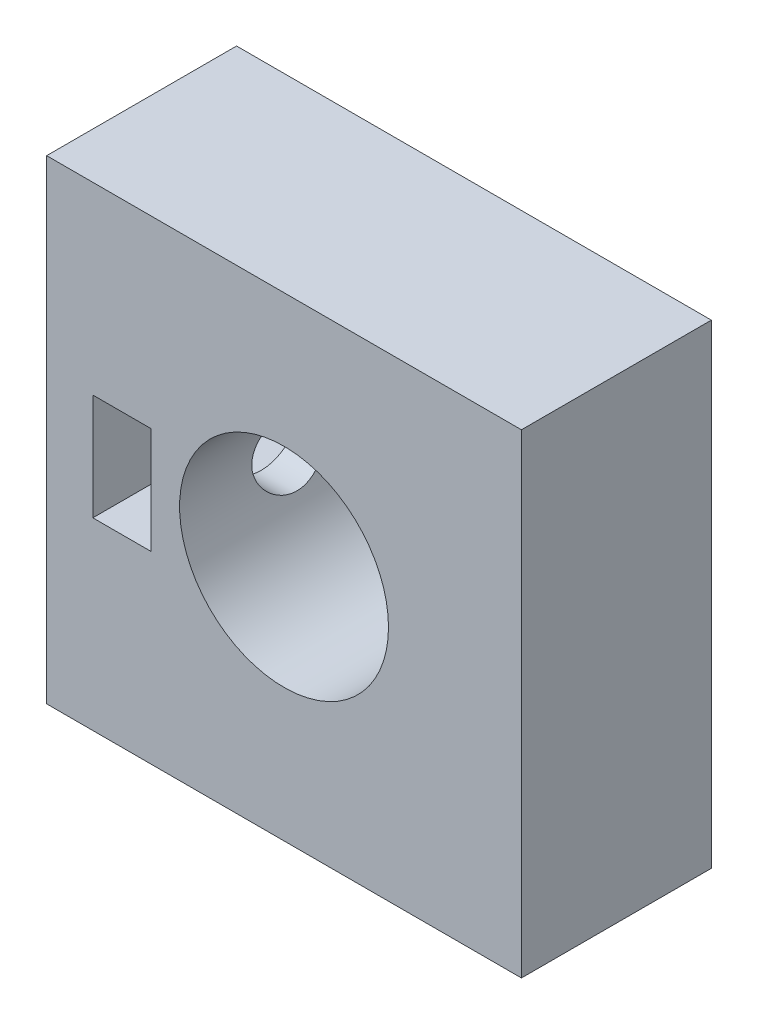
from build123d import *

# Parameters (mm, degrees)
CROQUIS1_W                 = 25
CROQUIS1_H                 = 25
CROQUIS1_R                 = 5.5
SALIENTE_EXTRUIR1_DEPTH    = 10
CORTAR_EXTRUIR1_REACH      = 38.742
CORTAR_EXTRUIR1_END_RADIUS = 5.5
CROQUIS2_R                 = 2
CROQUIS3_W                 = 3.068049468
CROQUIS3_H                 = 5.6
CORTAR_EXTRUIR2_DEPTH      = 37.742346169


with BuildPart() as part:
    # Croquis1 → Saliente-Extruir1 (new body)
    with BuildSketch(Plane.XY):
        with Locations((12.5, 12.5)):
            Rectangle(CROQUIS1_W, CROQUIS1_H)
        with Locations((12.5, 12.5)):
            Circle(CROQUIS1_R, mode=Mode.SUBTRACT)
    extrude(amount=SALIENTE_EXTRUIR1_DEPTH)

    # Cortar-Extruir1: up to this cylinder (the profile starts outside it)
    cortar_extruir1_end = Plane(origin=(12.5, 12.5, 4.2), z_dir=(0, 0, -1)) * Cylinder(CORTAR_EXTRUIR1_END_RADIUS, 89.484, mode=Mode.PRIVATE)
    # Croquis2 → Cortar-Extruir1 (cut, up to the surface)
    with BuildSketch(Plane.ZY, mode=Mode.PRIVATE) as cortar_extruir1_sk1:
        with Locations((4.2, 12.5)):
            Circle(CROQUIS2_R)
    cortar_extruir1_tool1 = extrude(cortar_extruir1_sk1.sketch, amount=-CORTAR_EXTRUIR1_REACH, mode=Mode.PRIVATE) - cortar_extruir1_end
    add(cortar_extruir1_tool1.solids().sort_by_distance((0, 12.5, 4.2))[0], mode=Mode.SUBTRACT)

    # Croquis3 → Cortar-Extruir2 (cut, through all)
    with BuildSketch(Plane(origin=(0, 0, 0), x_dir=(-1, 0, 0), z_dir=(0, 0, -1))):
        with Locations((-3.965975266, 12.5)):
            Rectangle(CROQUIS3_W, CROQUIS3_H)
    extrude(amount=-CORTAR_EXTRUIR2_DEPTH, mode=Mode.SUBTRACT)


solid = part.part
